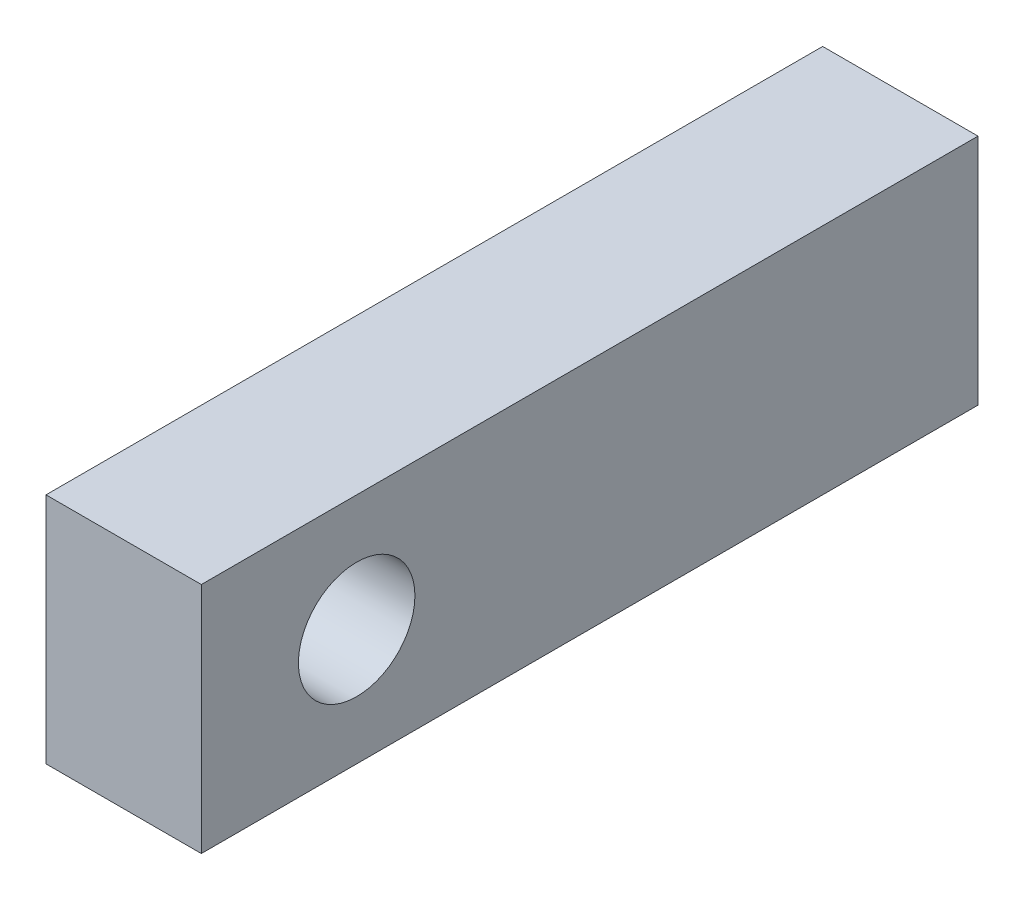
from build123d import *

# Parameters (mm, degrees)
SKETCH1_W           = 25.4
SKETCH1_H           = 38.1
BOSS_EXTRUDE1_DEPTH = 127
SKETCH2_R           = 9.525
CUT_EXTRUDE1_DEPTH  = 136.002851822


with BuildPart() as part:
    # Sketch1 → Boss-Extrude1 (new body)
    with BuildSketch(Plane.XY):
        with Locations((12.7, 19.05)):
            Rectangle(SKETCH1_W, SKETCH1_H)
    extrude(amount=BOSS_EXTRUDE1_DEPTH)

    # Sketch2 → Cut-Extrude1 (cut, through all)
    with BuildSketch(Plane(origin=(25.4, 0, 0), x_dir=(0, 0, -1), z_dir=(1, 0, 0))):
        with Locations((-101.6, 19.05)):
            Circle(SKETCH2_R)
    extrude(amount=-CUT_EXTRUDE1_DEPTH, mode=Mode.SUBTRACT)


solid = part.part
